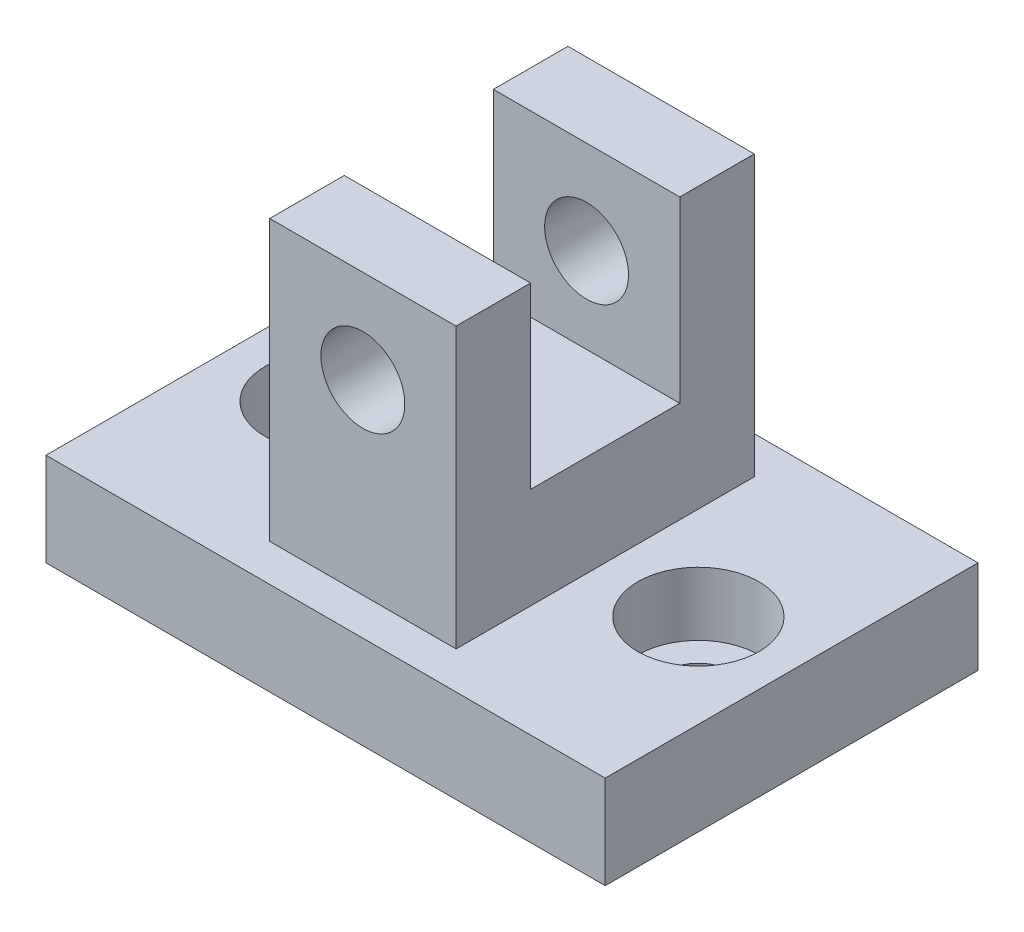
from build123d import *

# Parameters (mm, degrees)
SKETCH1_W                                           = 30
SKETCH1_H                                           = 20
BOSS_EXTRUDE1_DEPTH                                 = 5
SKETCH2_W                                           = 10
SKETCH2_H                                           = 16
BOSS_EXTRUDE2_DEPTH                                 = 15
SKETCH3_W                                           = 8
SKETCH3_H                                           = 9.586057572
CUT_EXTRUDE1_DEPTH                                  = 31
SKETCH4_R                                           = 2.25
CUT_EXTRUDE2_DEPTH                                  = 31.805843601
SKETCH5_R                                           = 1.75
CUT_EXTRUDE3_DEPTH                                  = 15
CBORE_FOR_M3_HEX_SOCKET_HEAD_CAP_SCREW1_D           = 3.4
CBORE_FOR_M3_HEX_SOCKET_HEAD_CAP_SCREW1_CBORE_D     = 6.5
CBORE_FOR_M3_HEX_SOCKET_HEAD_CAP_SCREW1_CBORE_DEPTH = 3.4


with BuildPart() as part:
    # Sketch1 → Boss-Extrude1 (new body)
    with BuildSketch(Plane(origin=(0, 0, 0), x_dir=(1, 0, 0), z_dir=(0, 1, 0))):
        Rectangle(SKETCH1_W, SKETCH1_H)
    extrude(amount=BOSS_EXTRUDE1_DEPTH)

    # Sketch2 → Boss-Extrude2 (add)
    with BuildSketch(Plane(origin=(0, 5, 0), x_dir=(1, 0, 0), z_dir=(0, 1, 0))):
        Rectangle(SKETCH2_W, SKETCH2_H)
    extrude(amount=BOSS_EXTRUDE2_DEPTH)

    # Sketch3 → Cut-Extrude1 (cut, through all)
    with BuildSketch(Plane.ZY.offset(5)):
        with Locations((0, 15.206971214)):
            Rectangle(SKETCH3_W, SKETCH3_H)
    extrude(amount=-CUT_EXTRUDE1_DEPTH, mode=Mode.SUBTRACT)

    # Sketch4 → Cut-Extrude2 (cut, through all)
    with BuildSketch(Plane(origin=(0, 0, -8), x_dir=(-1, 0, 0), z_dir=(0, 0, -1))):
        with Locations((0, 15)):
            Circle(SKETCH4_R)
    extrude(amount=-CUT_EXTRUDE2_DEPTH, mode=Mode.SUBTRACT)

    # Sketch5 → Cut-Extrude3 (cut)
    with BuildSketch(Plane(origin=(0, 5, 0), x_dir=(1, 0, 0), z_dir=(0, 1, 0))):
        with Locations(Location((-10, 0, 0), (0, 0, 270))):
            Circle(SKETCH5_R)
        with Locations(Location((10, 0, 0), (0, 0, 270))):
            Circle(SKETCH5_R)
    extrude(amount=-CUT_EXTRUDE3_DEPTH, mode=Mode.SUBTRACT)

    # CBORE for M3 Hex Socket Head Cap Screw1 (through all)
    with Locations(Plane(origin=(0, 5, 0), x_dir=(1, 0, 0), z_dir=(0, 1, 0))):
        with Locations((-10, 0), (10, 0)):
            CounterBoreHole(CBORE_FOR_M3_HEX_SOCKET_HEAD_CAP_SCREW1_D / 2, CBORE_FOR_M3_HEX_SOCKET_HEAD_CAP_SCREW1_CBORE_D / 2, CBORE_FOR_M3_HEX_SOCKET_HEAD_CAP_SCREW1_CBORE_DEPTH)


solid = part.part
